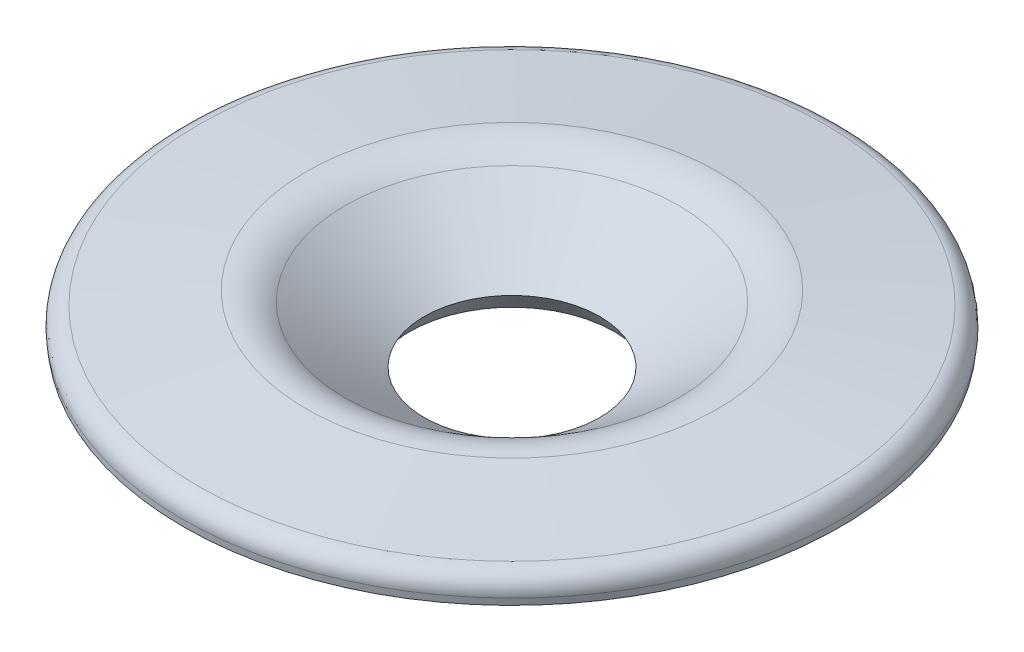
from build123d import *

# Parameters (mm, degrees)
FILLET1_R = 1


with BuildPart() as part:
    # Sketch1 → Revolve-Thin2 (revolve)
    with BuildSketch(Plane.XY, mode=Mode.PRIVATE) as revolve_thin2_sk:
        with BuildLine():
            Line((4.76, 0), (9.049484193, 3.069764451))
            ThreePointArc((9.049484193, 3.069764451), (10.0542655, 3.537150049), (11.160173373, 3.607878762))
            Line((11.160173373, 3.607878762), (18, 2.77))
            Line((18, 2.77), (17.832204304, 1.400239216))
            Line((17.832204304, 1.400239216), (10.992377677, 2.238117978))
            ThreePointArc((10.992377677, 2.238117978), (10.395187426, 2.199924473), (9.85260552, 1.94753625))
            Line((9.85260552, 1.94753625), (5.563121327, -1.122228201))
            Line((5.563121327, -1.122228201), (4.76, 0))
        make_face()
    revolve(revolve_thin2_sk.sketch.rotate(Axis((0, 0, 0), (0, 1, 0)), 90), axis=Axis((0, 0, 0), (0, 1, 0)))

    # Fillet1
    fillet1_edges = [part.edges().sort_by_distance(p)[0] for p in [
        (0, 2.77, 18),
    ]]
    fillet(fillet1_edges, radius=FILLET1_R)


solid = part.part
